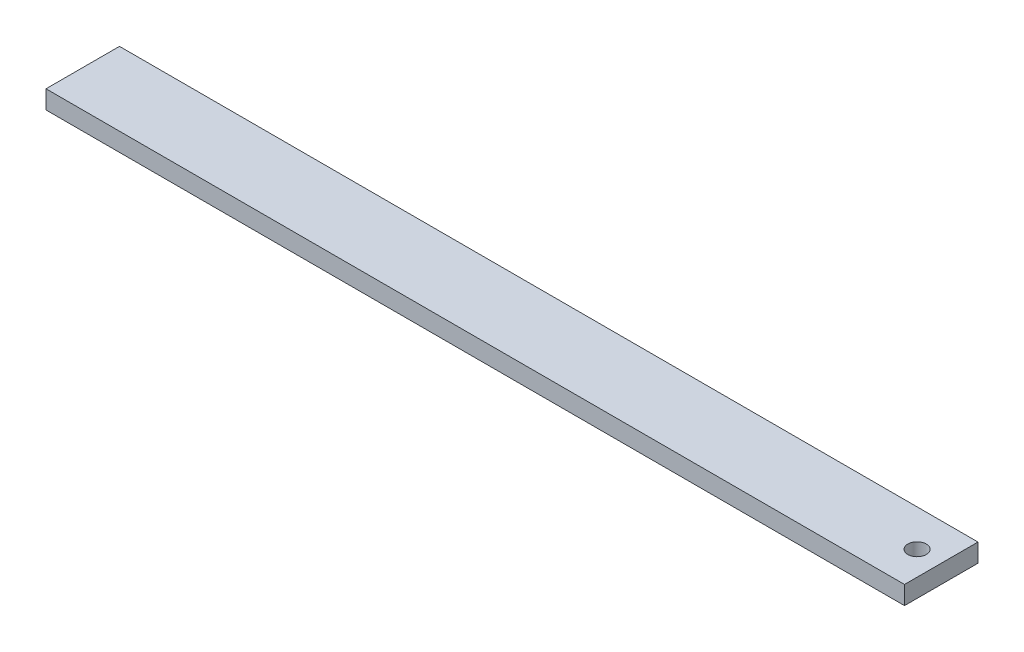
from build123d import *

# Parameters (mm, degrees)
SKETCH1_W           = 280.4
SKETCH1_H           = 12
BOSS_EXTRUDE1_DEPTH = 3
SKETCH3_R           = 1.5
CUT_EXTRUDE1_DEPTH  = 141.360393274
SKETCH6_W           = 140.2
SKETCH6_H           = 12
CUT_EXTRUDE2_DEPTH  = 141.360393274
SKETCH7_W           = 1.95
SKETCH7_H           = 1.95
CUT_EXTRUDE3_DEPTH  = 4
FILLET1_R           = 0.6


with BuildPart() as part:
    # Sketch1 → Boss-Extrude1 (new body)
    with BuildSketch(Plane(origin=(0, 0, 0), x_dir=(1, 0, 0), z_dir=(0, 1, 0))):
        Rectangle(SKETCH1_W, SKETCH1_H)
    extrude(amount=BOSS_EXTRUDE1_DEPTH)

    # Sketch3 → Cut-Extrude1 (cut, through all)
    with BuildSketch(Plane(origin=(0, 3, 0), x_dir=(1, 0, 0), z_dir=(0, 1, 0))):
        with Locations(Location((-136.25, 0, 0), (0, 0, 270))):
            Circle(SKETCH3_R)
        with Locations(Location((136.25, 0, 0), (0, 0, 270))):
            Circle(SKETCH3_R)
    extrude(amount=-CUT_EXTRUDE1_DEPTH, mode=Mode.SUBTRACT)

    # Sketch6 → Cut-Extrude2 (cut, through all)
    with BuildSketch(Plane(origin=(0, 3, 0), x_dir=(1, 0, 0), z_dir=(0, 1, 0))):
        with Locations((-70.1, 0)):
            Rectangle(SKETCH6_W, SKETCH6_H)
    extrude(amount=-CUT_EXTRUDE2_DEPTH, mode=Mode.SUBTRACT)

    # Sketch7 → Cut-Extrude3 (cut)
    with BuildSketch(Plane.ZY):
        with Locations((0, 1.5)):
            Rectangle(SKETCH7_W, SKETCH7_H)
    extrude(amount=-CUT_EXTRUDE3_DEPTH, mode=Mode.SUBTRACT)

    # Fillet1
    fillet1_edges = [part.edges().sort_by_distance(p)[0] for p in [
        (4, 1.5, 0.975),
        (4, 0.525, 0),
        (4, 1.5, -0.975),
        (4, 2.475, 0),
    ]]
    fillet(fillet1_edges, radius=FILLET1_R)


solid = part.part
